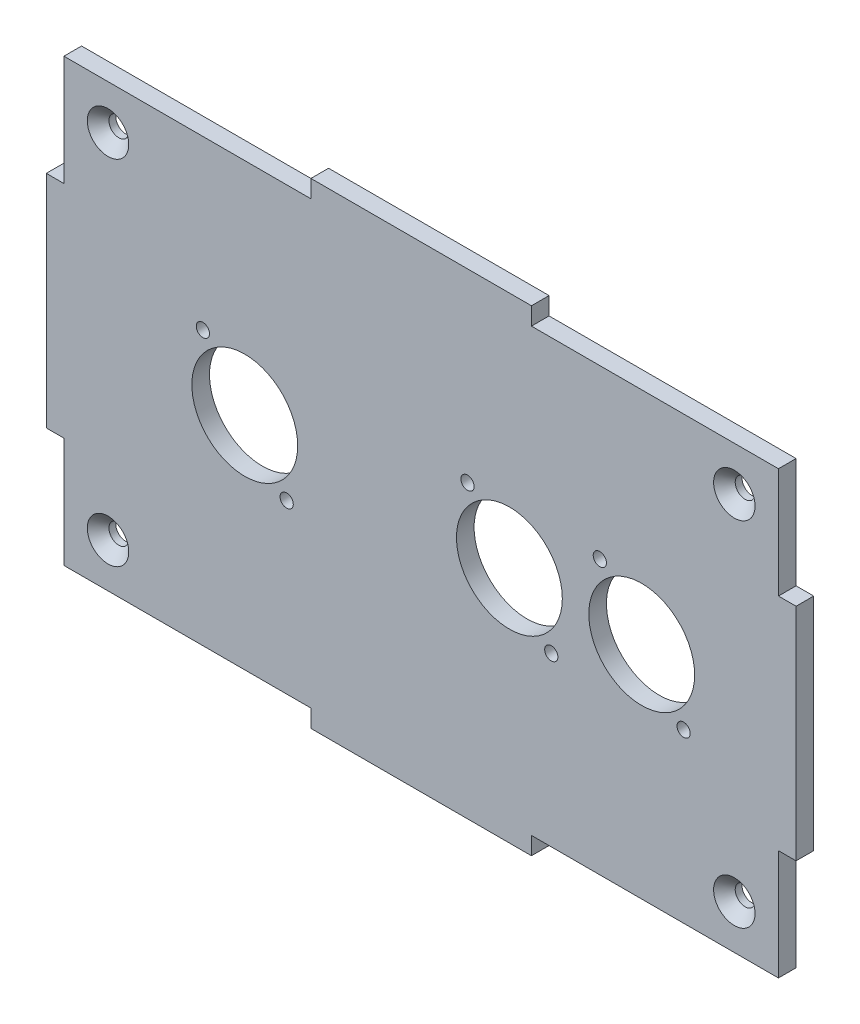
from build123d import *

# Parameters (mm, degrees)
SKETCH1_W                                    = 162
SKETCH1_H                                    = 100
SKETCH1_W_2                                  = 50
SKETCH1_H_2                                  = 4
SKETCH1_W_3                                  = 4
SKETCH1_H_3                                  = 50
BOSS_EXTRUDE2_DEPTH                          = 4
CUT_EXTRUDE1_REACH                           = 102.782
SKETCH2_R                                    = 12
CSK_FOR_M4_COUNTERSUNK_FLAT_HEAD_SCR_2_COUNT = 2
CSK_FOR_M4_COUNTERSUNK_FLAT_HEAD_SCR_2_PITCH = 142
CSK_FOR_M4_COUNTERSUNK_FLAT_HEAD_SCR_3_COUNT = 2
CSK_FOR_M4_COUNTERSUNK_FLAT_HEAD_SCR_3_PITCH = 162.984661855
CSK_FOR_M4_COUNTERSUNK_FLAT_HEAD_SCR_4_COUNT = 2
CSK_FOR_M4_COUNTERSUNK_FLAT_HEAD_SCR_4_PITCH = 80
F_3_0MM_DOWEL_HOLE1_D                        = 3


with BuildPart() as part:
    # Sketch1 → Boss-Extrude2 (new body)
    with BuildSketch(Plane.XY):
        Rectangle(SKETCH1_W, SKETCH1_H)
        with Locations((0, 52)):
            Rectangle(SKETCH1_W_2, SKETCH1_H_2)
        with Locations((83, 0)):
            Rectangle(SKETCH1_W_3, SKETCH1_H_3)
        with Locations((-83, 0)):
            Rectangle(SKETCH1_W_3, SKETCH1_H_3)
        with Locations((0, -52)):
            Rectangle(SKETCH1_W_2, SKETCH1_H_2)
    extrude(amount=BOSS_EXTRUDE2_DEPTH)

    # Sketch2 → Cut-Extrude1 (cut, up to next)
    with BuildSketch(Plane.XY.offset(4), mode=Mode.PRIVATE) as cut_extrude1_sk1:
        with Locations((-40, 0)):
            Circle(SKETCH2_R)
    cut_extrude1_tool1 = extrude(cut_extrude1_sk1.sketch, amount=-CUT_EXTRUDE1_REACH, mode=Mode.PRIVATE) & part.part
    # Sketch2 → Cut-Extrude1 (cut, up to next)
    with BuildSketch(Plane.XY.offset(4), mode=Mode.PRIVATE) as cut_extrude1_sk2:
        with Locations((20, 0)):
            Circle(SKETCH2_R)
    cut_extrude1_tool2 = extrude(cut_extrude1_sk2.sketch, amount=-CUT_EXTRUDE1_REACH, mode=Mode.PRIVATE) & part.part
    # Sketch2 → Cut-Extrude1 (cut, up to next)
    with BuildSketch(Plane.XY.offset(4), mode=Mode.PRIVATE) as cut_extrude1_sk3:
        with Locations((50, 0)):
            Circle(SKETCH2_R)
    cut_extrude1_tool3 = extrude(cut_extrude1_sk3.sketch, amount=-CUT_EXTRUDE1_REACH, mode=Mode.PRIVATE) & part.part
    add(cut_extrude1_tool1.solids().sort_by_distance((-40, 0, 4))[0], mode=Mode.SUBTRACT)
    add(cut_extrude1_tool2.solids().sort_by_distance((20, 0, 4))[0], mode=Mode.SUBTRACT)
    add(cut_extrude1_tool3.solids().sort_by_distance((50, 0, 4))[0], mode=Mode.SUBTRACT)

    # Sketch4 → CSK for M4 Countersunk Flat Head Screw1 (revolve, cut)
    with BuildSketch(Plane(origin=(-71, 40, 4), x_dir=(0, -1, 0), z_dir=(1, 0, 0))):
        Polygon((0, 0), (0, 4), (2.25, 4), (2.25, 2.45), (4.7, 0), align=None)
    csk_for_m4_countersunk_flat_head_screw1 = revolve(axis=Axis((-71, 40, 10.35), (0, 0, -1)), mode=Mode.SUBTRACT)

    # CSK for M4 Countersunk Flat Head Scr 2: CSK for M4 Countersunk Flat Head Screw1 ×2
    with Locations(*[(i * CSK_FOR_M4_COUNTERSUNK_FLAT_HEAD_SCR_2_PITCH, 0, 0) for i in range(1, CSK_FOR_M4_COUNTERSUNK_FLAT_HEAD_SCR_2_COUNT)]):
        add(csk_for_m4_countersunk_flat_head_screw1, mode=Mode.SUBTRACT)

    # CSK for M4 Countersunk Flat Head Scr 3: CSK for M4 Countersunk Flat Head Screw1 ×2
    with Locations(*[Vector(0.8712476277448776, -0.49084373394077596, 0) * (i * CSK_FOR_M4_COUNTERSUNK_FLAT_HEAD_SCR_3_PITCH) for i in range(1, CSK_FOR_M4_COUNTERSUNK_FLAT_HEAD_SCR_3_COUNT)]):
        add(csk_for_m4_countersunk_flat_head_screw1, mode=Mode.SUBTRACT)

    # CSK for M4 Countersunk Flat Head Scr 4: CSK for M4 Countersunk Flat Head Screw1 ×2
    with Locations(*[(0, -i * CSK_FOR_M4_COUNTERSUNK_FLAT_HEAD_SCR_4_PITCH, 0) for i in range(1, CSK_FOR_M4_COUNTERSUNK_FLAT_HEAD_SCR_4_COUNT)]):
        add(csk_for_m4_countersunk_flat_head_screw1, mode=Mode.SUBTRACT)

    # Ø3.0mm Dowel Hole1 (through all)
    with Locations(Plane(origin=(-49.5, 12, 4), x_dir=(1, 0, 0), z_dir=(0, 0, 1))):
        with Locations((0, 0), (19, -24), (60, 0), (79, -24), (90, 0), (109, -24)):
            Hole(F_3_0MM_DOWEL_HOLE1_D / 2)


solid = part.part
